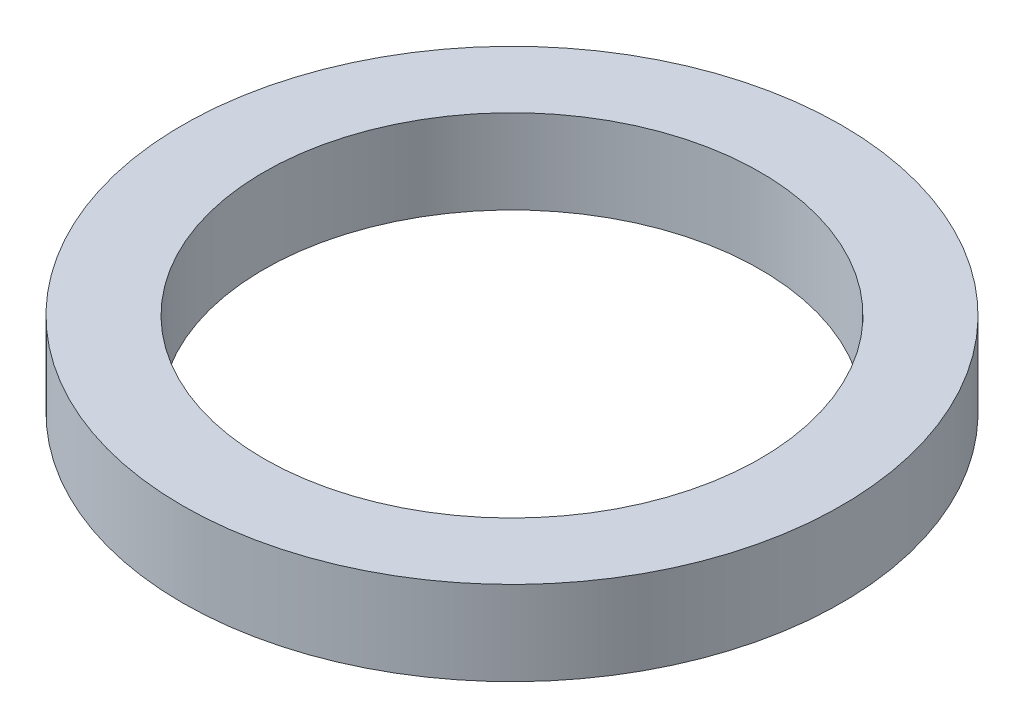
from build123d import *

# Parameters (mm, degrees)
SKETCH1_R           = 38.505
SKETCH1_R_2         = 29
BOSS_EXTRUDE1_DEPTH = 4.92


with BuildPart() as part:
    # Sketch1 → Boss-Extrude1 (new, symmetric)
    with BuildSketch(Plane(origin=(0, 0, 0), x_dir=(1, 0, 0), z_dir=(0, 1, 0))):
        with Locations(Location((0, 0, 0), (0, 0, 270))):
            Circle(SKETCH1_R)
        with Locations(Location((0, 0, 0), (0, 0, 270))):
            Circle(SKETCH1_R_2, mode=Mode.SUBTRACT)
    extrude(amount=BOSS_EXTRUDE1_DEPTH, both=True)


solid = part.part
